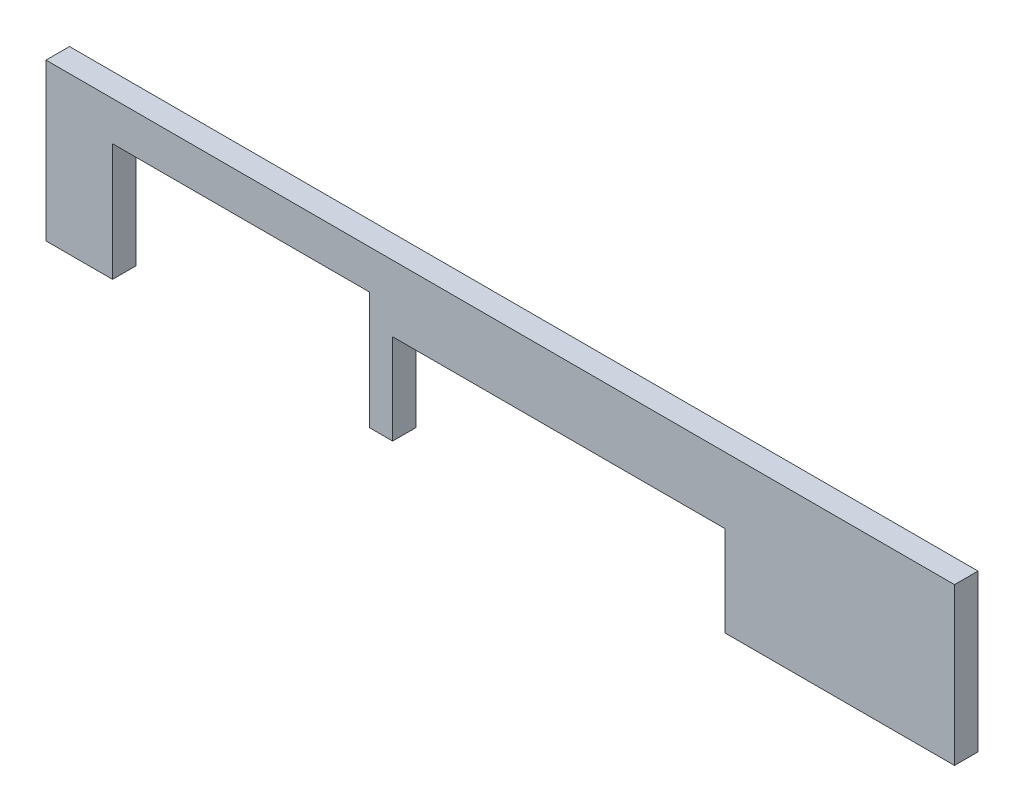
from build123d import *

# Parameters (mm, degrees)
BOSS_EXTRUDE1_DEPTH = 3


with BuildPart() as part:
    # Sketch1 → Boss-Extrude1 (new body)
    with BuildSketch(Plane.XY):
        Polygon((0, 0), (8.5, 0), (8.5, 15), (41.336244699, 15), (41.336244699, 0), (44.258859767, 0), (44.258859767, 11.536626376), (86.674025379, 11.536626376), (86.674025379, 0), (116, 0), (116, 20), (0, 20), align=None)
    extrude(amount=BOSS_EXTRUDE1_DEPTH)


solid = part.part
